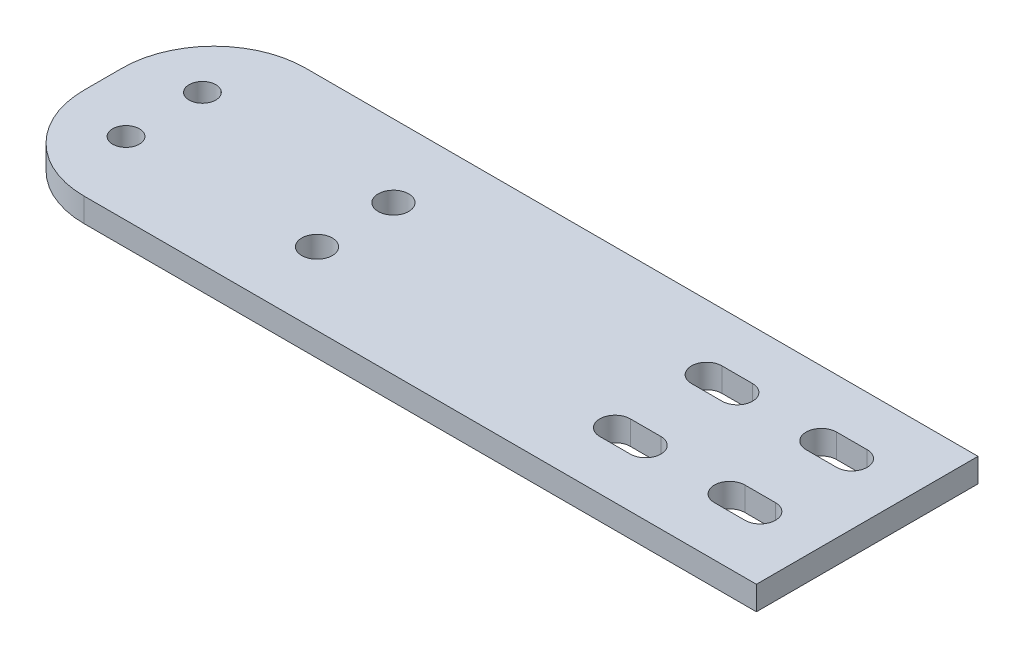
from build123d import *

# Parameters (mm, degrees)
SKETCH1_W           = 200
SKETCH1_H           = 58
BOSS_EXTRUDE1_DEPTH = 6.25
SKETCH2_R           = 3.5
CUT_EXTRUDE1_DEPTH  = 203.188185857
FILLET1_R           = 24
SKETCH3_R           = 4
CUT_EXTRUDE2_DEPTH  = 10


with BuildPart() as part:
    # Sketch1 → Boss-Extrude1 (new body)
    with BuildSketch(Plane(origin=(0, 0, 0), x_dir=(1, 0, 0), z_dir=(0, 1, 0))):
        with Locations((100, 0)):
            Rectangle(SKETCH1_W, SKETCH1_H)
    extrude(amount=BOSS_EXTRUDE1_DEPTH)

    # Sketch2 → Cut-Extrude1 (cut, through all)
    with BuildSketch(Plane(origin=(0, 0, 0), x_dir=(1, 0, 0), z_dir=(0, 1, 0))):
        with Locations(Location((16, 10, 0), (0, 0, 270))):
            Circle(SKETCH2_R)
        with Locations(Location((16, -10, 0), (0, 0, 270))):
            Circle(SKETCH2_R)
        with BuildLine():
            Line((176, 16), (184, 16))
            ThreePointArc((184, 16), (188, 12), (184, 8))
            Line((184, 8), (176, 8))
            ThreePointArc((176, 8), (172, 12), (176, 16))
        make_face()
        with BuildLine():
            Line((146, 16), (154, 16))
            ThreePointArc((154, 16), (158, 12), (154, 8))
            Line((154, 8), (146, 8))
            ThreePointArc((146, 8), (142, 12), (146, 16))
        make_face()
        with BuildLine():
            Line((146, -8), (154, -8))
            ThreePointArc((154, -8), (158, -12), (154, -16))
            Line((154, -16), (146, -16))
            ThreePointArc((146, -16), (142, -12), (146, -8))
        make_face()
        with BuildLine():
            Line((176, -8), (184, -8))
            ThreePointArc((184, -8), (188, -12), (184, -16))
            Line((184, -16), (176, -16))
            ThreePointArc((176, -16), (172, -12), (176, -8))
        make_face()
    extrude(amount=CUT_EXTRUDE1_DEPTH, mode=Mode.SUBTRACT)

    # Fillet1
    fillet1_edges = [part.edges().sort_by_distance(p)[0] for p in [
        (0, 3.125, -29),
        (0, 3.125, 29),
    ]]
    fillet(fillet1_edges, radius=FILLET1_R)

    # Sketch3 → Cut-Extrude2 (cut)
    with BuildSketch(Plane(origin=(0, 0, 0), x_dir=(1, 0, 0), z_dir=(0, 1, 0))):
        with Locations(Location((66, -10, 0), (0, 0, 270))):
            Circle(SKETCH3_R)
        with Locations(Location((66, 10, 0), (0, 0, 270))):
            Circle(SKETCH3_R)
    extrude(amount=CUT_EXTRUDE2_DEPTH, mode=Mode.SUBTRACT)


solid = part.part
